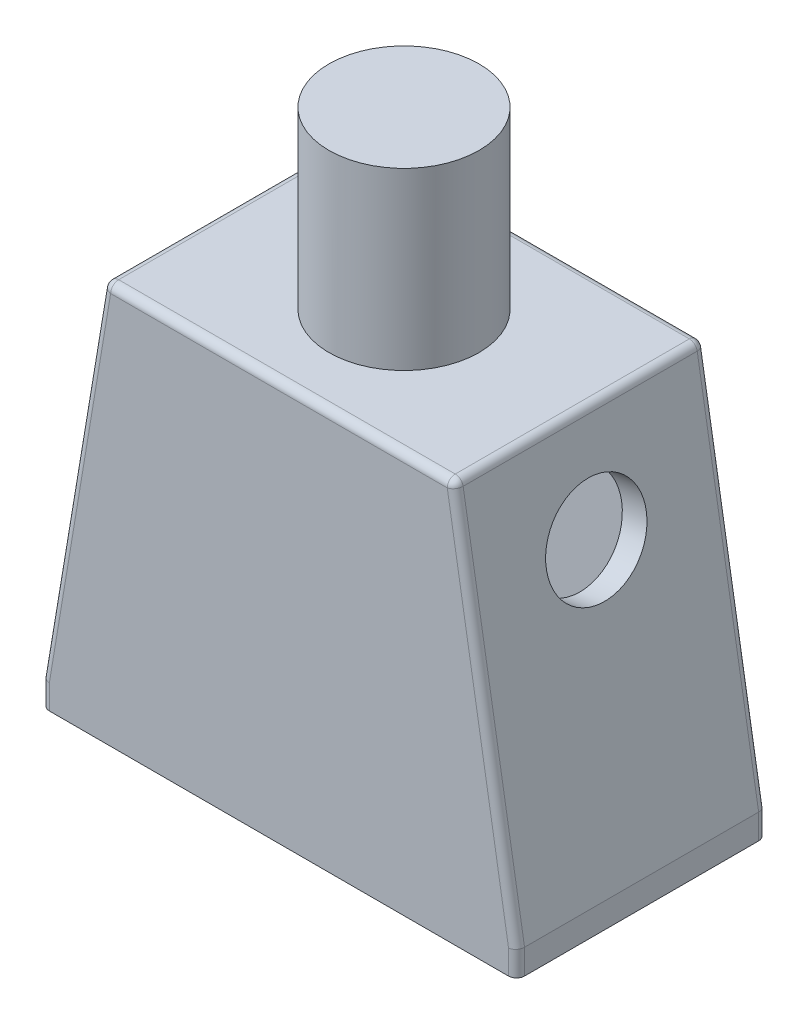
from build123d import *

# Parameters (mm, degrees)
BOSS_EXTRUDE1_DEPTH = 3.96875
FILLET1_R           = 0.254
SHELL2_T            = -0.79375
SKETCH2_R           = 2.38125
BOSS_EXTRUDE2_DEPTH = 5.55625
SKETCH4_R           = 1.5875
CUT_EXTRUDE1_DEPTH  = 1.905
SKETCH5_R           = 1.5875
CUT_EXTRUDE2_DEPTH  = 1.905


with BuildPart() as part:
    # Sketch1 → Boss-Extrude1 (new, symmetric)
    with BuildSketch(Plane.XY):
        Polygon((0, 0), (15.08125, 0), (15.08125, 0.79375), (13.096875, 12.7), (1.984375, 12.7), (0, 0.79375), align=None)
    extrude(amount=BOSS_EXTRUDE1_DEPTH, both=True)

    # Fillet1
    fillet1_edges = [part.edges().sort_by_distance(p)[0] for p in [
        (1.984375, 12.7, 0),
        (13.096875, 12.7, 0),
        (15.08125, 0.396875, 3.96875),
        (14.0890625, 6.746875, 3.96875),
        (7.540625, 12.7, 3.96875),
        (0.9921875, 6.746875, 3.96875),
        (0, 0.396875, 3.96875),
        (0.9921875, 6.746875, -3.96875),
        (7.540625, 12.7, -3.96875),
        (14.0890625, 6.746875, -3.96875),
        (15.08125, 0.396875, -3.96875),
        (0, 0.396875, -3.96875),
    ]]
    fillet(fillet1_edges, radius=FILLET1_R)

    # Shell2
    shell2_openings = [part.faces().sort_by_distance(p)[0] for p in [
        (7.540625, 0, 0),
    ]]
    offset(amount=SHELL2_T, openings=shell2_openings, kind=Kind.INTERSECTION)

    # Sketch2 → Boss-Extrude2 (add)
    with BuildSketch(Plane(origin=(0, 12.7, 0), x_dir=(1, 0, 0), z_dir=(0, 1, 0))):
        with Locations((7.540625, 0)):
            Circle(SKETCH2_R)
    extrude(amount=BOSS_EXTRUDE2_DEPTH)

    # Sketch4 → Cut-Extrude1 (cut)
    with BuildSketch(Plane(origin=(14.802364865, 2.467060811, 0), x_dir=(0, 0, -1), z_dir=(0.9863939238321437, 0.16439898730535743, 0))):
        with Locations(Location((0, 7.045657773, 0), (0, 0, 90))):
            Circle(SKETCH4_R)
    extrude(amount=-CUT_EXTRUDE1_DEPTH, mode=Mode.SUBTRACT)

    # Sketch5 → Cut-Extrude2 (cut)
    with BuildSketch(Plane(origin=(-0.128716216, 0.021452703, 0), x_dir=(0, 0, 1), z_dir=(-0.9863939238321439, 0.16439898730535724, 0))):
        with Locations(Location((0, 9.525, 0), (0, 0, 270))):
            Circle(SKETCH5_R)
    extrude(amount=-CUT_EXTRUDE2_DEPTH, mode=Mode.SUBTRACT)


solid = part.part
